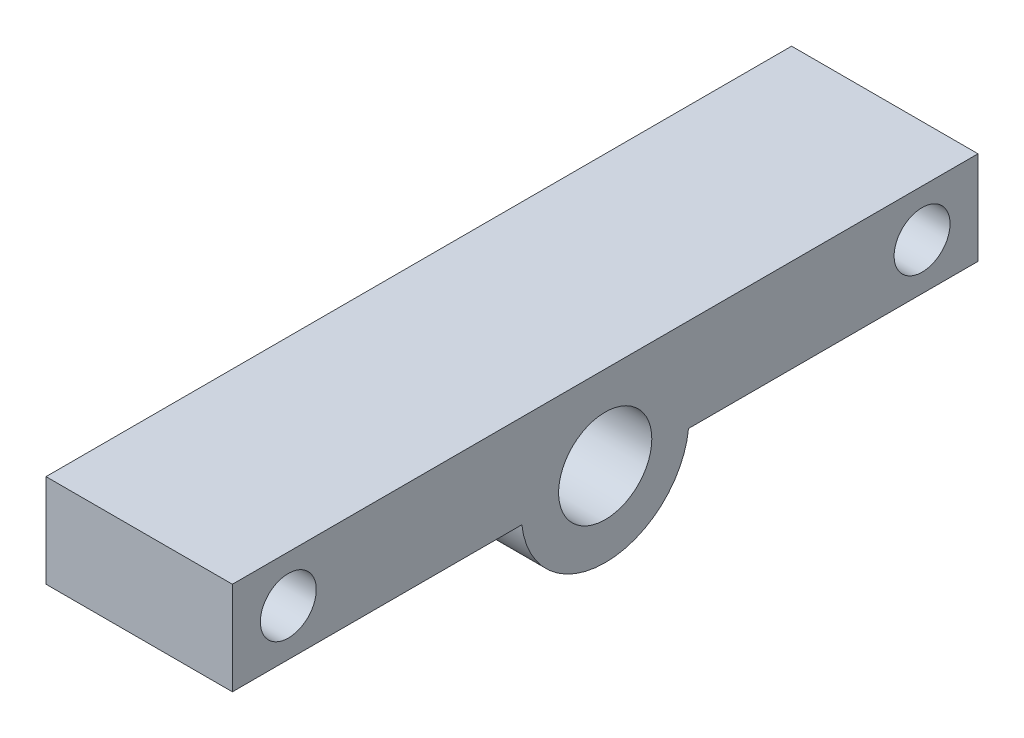
from build123d import *

# Parameters (mm, degrees)
SZKIC1_R                    = 2.5
SZKIC1_R_2                  = 1.5
DODANIE_WYCI_GNI_CIE1_DEPTH = 10


with BuildPart() as part:
    # Szkic1 → Dodanie-wyciągnięcie1 (new body)
    with BuildSketch(Plane(origin=(0, 0, 0), x_dir=(0, 0, -1), z_dir=(1, 0, 0))):
        with BuildLine():
            Line((-20, 4.5), (20, 4.5))
            Line((20, 4.5), (20, -0.5))
            Line((20, -0.5), (4.472135955, -0.5))
            ThreePointArc((4.472135955, -0.5), (0, -4.5), (-4.472135955, -0.5))
            Line((-4.472135955, -0.5), (-20, -0.5))
            Line((-20, -0.5), (-20, 4.5))
        make_face()
        Circle(SZKIC1_R, mode=Mode.SUBTRACT)
        with Locations((17, 2)):
            Circle(SZKIC1_R_2, mode=Mode.SUBTRACT)
        with Locations(Location((-17, 2, 0), (0, 0, 180))):
            Circle(SZKIC1_R_2, mode=Mode.SUBTRACT)
    extrude(amount=DODANIE_WYCI_GNI_CIE1_DEPTH)


solid = part.part
